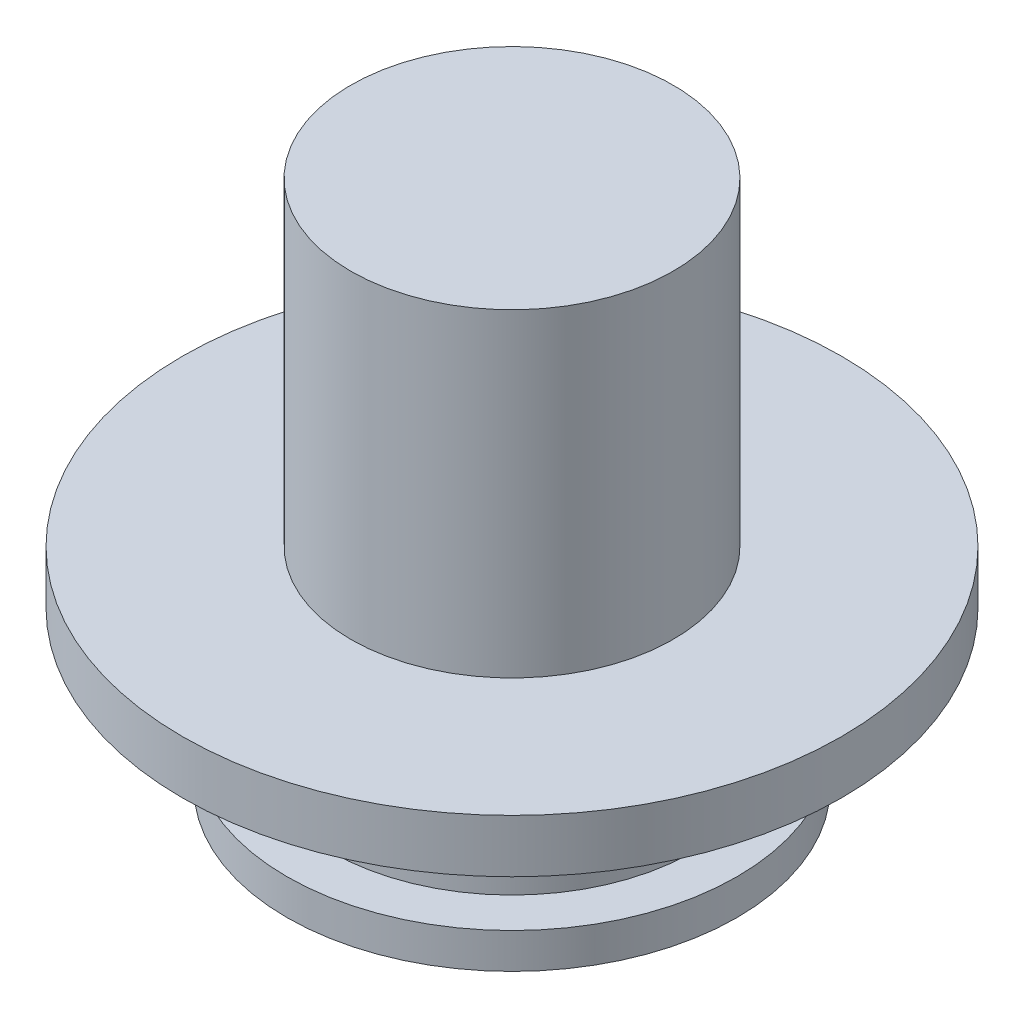
from build123d import *

# Parameters (mm, degrees)
SKETCH1_R           = 6.35
BOSS_EXTRUDE1_DEPTH = 1
SKETCH3_R           = 9.3
BOSS_EXTRUDE3_DEPTH = 1.5
SKETCH5_R           = 4.55
BOSS_EXTRUDE4_DEPTH = 9
BOSS_EXTRUDE5_REACH = 21.136
SKETCH2_R           = 5.12445119


with BuildPart() as part:
    # Sketch1 → Boss-Extrude1 (new body)
    with BuildSketch(Plane(origin=(0, 0, 0), x_dir=(1, 0, 0), z_dir=(0, 1, 0))):
        with Locations(Location((0, 0, 0), (0, 0, 270))):
            Circle(SKETCH1_R)
    extrude(amount=BOSS_EXTRUDE1_DEPTH)


with BuildPart() as body_2:
    # Sketch3 → Boss-Extrude3 (new body)
    with BuildSketch(Plane(origin=(0, 4.4, 0), x_dir=(1, 0, 0), z_dir=(0, 1, 0))):
        with Locations(Location((0, 0, 0), (0, 0, 270))):
            Circle(SKETCH3_R)
    extrude(amount=BOSS_EXTRUDE3_DEPTH)

    # Sketch2 → Boss-Extrude5 (add, up to next)
    with BuildSketch(Plane(origin=(0, 1, 0), x_dir=(1, 0, 0), z_dir=(0, 1, 0)), mode=Mode.PRIVATE) as boss_extrude5_sk1:
        with Locations(Location((0, 0, 0), (0, 0, 270))):
            Circle(SKETCH2_R)
    boss_extrude5_tool1 = extrude(boss_extrude5_sk1.sketch, amount=BOSS_EXTRUDE5_REACH, mode=Mode.PRIVATE) - body_2.part

    add(part.part)  # Boss-Extrude5 merges part
    add(boss_extrude5_tool1.solids().sort_by_distance((0, 1, 0))[0])


with BuildPart() as body_3:
    # Sketch5 → Boss-Extrude4 (new body)
    with BuildSketch(Plane(origin=(0, 5.9, 0), x_dir=(1, 0, 0), z_dir=(0, 1, 0))):
        with Locations(Location((0, 0, 0), (0, 0, 270))):
            Circle(SKETCH5_R)
    extrude(amount=BOSS_EXTRUDE4_DEPTH)


solid = Compound([body_2.part, body_3.part])
